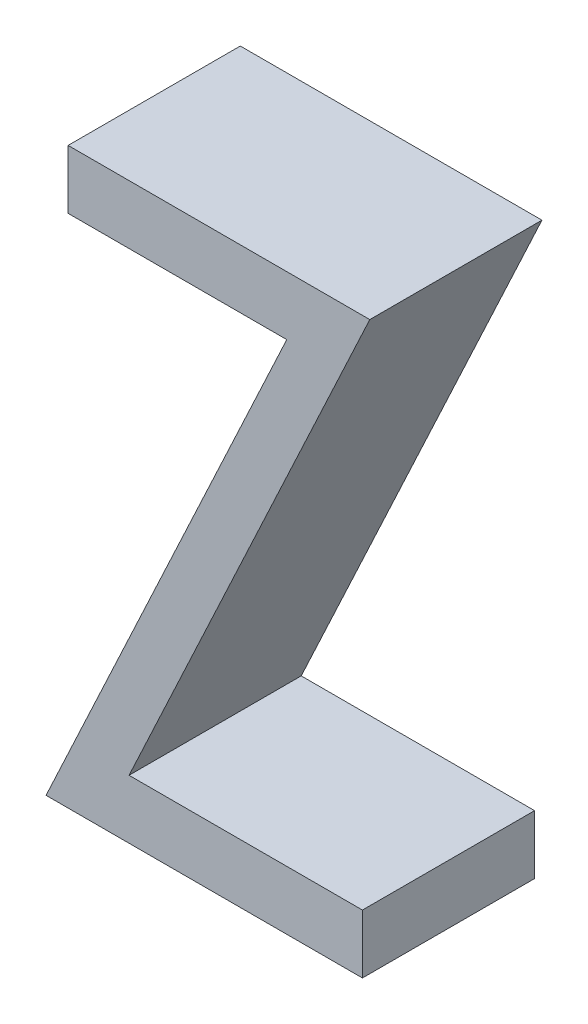
from build123d import *

# Parameters (mm, degrees)
BOSS_EXTRU_1_DEPTH = 1.5


with BuildPart() as part:
    # Esquisse1 → Boss.-Extru.1 (new body)
    with BuildSketch(Plane.XY):
        Polygon((-55.692811662, -18.366829234), (-55.692811662, -17.854008721), (-53.064606534, -17.854008721), (-55.161962303, -22.341188208), (-53.128709098, -22.341188208), (-53.128709098, -22.854008721), (-55.885119354, -22.854008721), (-53.787763585, -18.366829234), align=None)
    extrude(amount=BOSS_EXTRU_1_DEPTH)


solid = part.part
